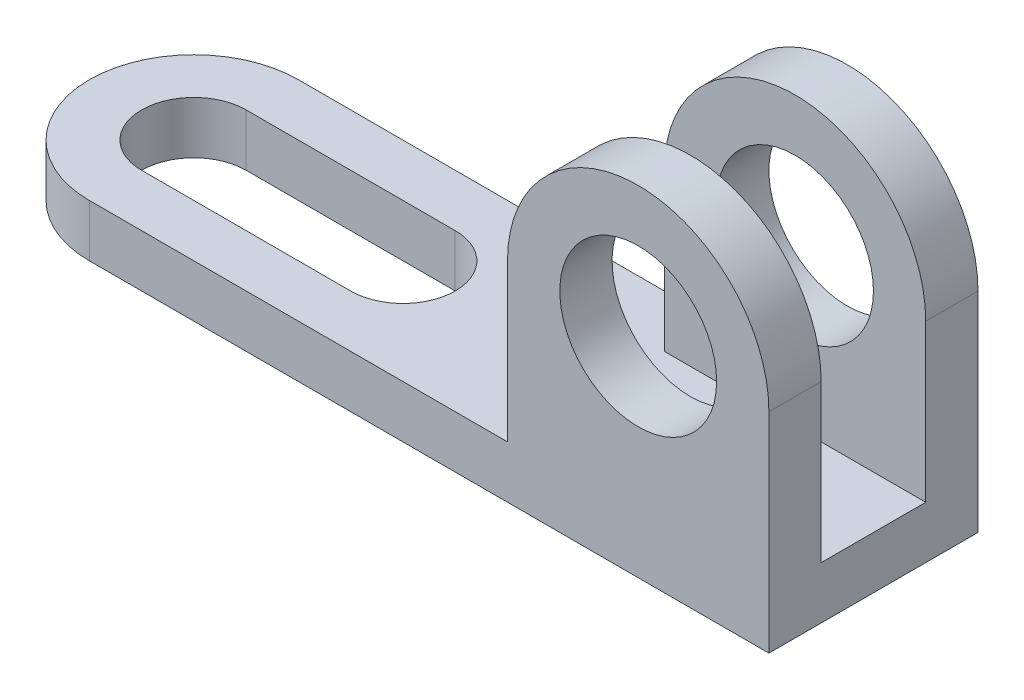
from build123d import *

# Parameters (mm, degrees)
Y_KSEKLIK_EKSTR_ZYON1_DEPTH = 10
Y_KSEKLIK_EKSTR_ZYON6_DEPTH = 40
IZIM6_R                     = 15
KES_EKSTR_ZYON1_DEPTH       = 40
IZIM7_W                     = 20
IZIM7_H                     = 55
KES_EKSTR_ZYON2_DEPTH       = 50


with BuildPart() as part:
    # Çizim1 → Yükseklik-Ekstrüzyon1 (new body)
    with BuildSketch(Plane(origin=(0, 0, 0), x_dir=(1, 0, 0), z_dir=(0, 1, 0))):
        with BuildLine():
            Line((18.624338624, 20), (-40, 20))
            ThreePointArc((-40, 20), (-60, 0), (-40, -20))
            Line((-40, -20), (26.71957672, -20))
            Line((26.71957672, -20), (52.91005291, -20))
            Line((52.91005291, -20), (90, -20))
            Line((90, -20), (90, 20))
            Line((90, 20), (52.91005291, 20))
            Line((52.91005291, 20), (18.624338624, 20))
        make_face()
        with BuildLine():
            ThreePointArc((-40, -10), (-50, 0), (-40, 10))
            Line((-40, 10), (0, 10))
            ThreePointArc((0, 10), (10, 0), (0, -10))
            Line((0, -10), (-40, -10))
        make_face(mode=Mode.SUBTRACT)
    extrude(amount=Y_KSEKLIK_EKSTR_ZYON1_DEPTH)

    # Çizim2 → Yükseklik-Ekstrüzyon6 (add)
    with BuildSketch(Plane.XY.offset(20)):
        with BuildLine():
            Line((90, 10), (40, 10))
            Line((40, 10), (40, 40))
            ThreePointArc((40, 40), (65, 65), (90, 40))
            Line((90, 40), (90, 10))
        make_face()
    extrude(amount=-Y_KSEKLIK_EKSTR_ZYON6_DEPTH)

    # Çizim6 → Kes-Ekstrüzyon1 (cut)
    with BuildSketch(Plane.XY.offset(20)):
        with Locations((65, 40)):
            Circle(IZIM6_R)
    extrude(amount=-KES_EKSTR_ZYON1_DEPTH, mode=Mode.SUBTRACT)

    # Çizim7 → Kes-Ekstrüzyon2 (cut)
    with BuildSketch(Plane(origin=(90, 0, 0), x_dir=(0, 0, -1), z_dir=(1, 0, 0))):
        with Locations((0, 37.5)):
            Rectangle(IZIM7_W, IZIM7_H)
    extrude(amount=-KES_EKSTR_ZYON2_DEPTH, mode=Mode.SUBTRACT)


solid = part.part
